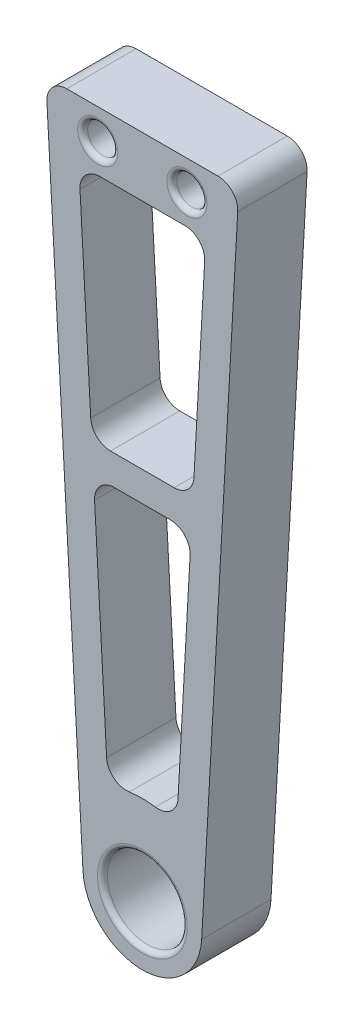
from build123d import *

# Parameters (mm, degrees)
SKETCH_1_R          = 11
SKETCH_1_R_2        = 3.5
SKETCH_1_R_3        = 1.01
SKETCH_1_R_4        = 6
SKETCH_1_R_5        = 4.025
EXTRUDE_1_DEPTH     = 7
SKETCH_2_R          = 1.525
EXTRUDE_2_DEPTH     = 7
SKETCH_3_W          = 24.553172336
SKETCH_3_H          = 36.576889883
CUT_EXTRUDE_1_DEPTH = 29
EXTRUDE_3_DEPTH     = 7
FILLET_1_R          = 2
FILLET_2_R          = 0.5


with BuildPart() as part:
    # 草图1 → 凸台-拉伸1 (new body)
    # profile 1 of 3: a face of its own
    with BuildSketch(Plane.XY):
        with BuildLine():
            ThreePointArc((10.983011573, -0.611111111), (0, -11), (-10.983011573, -0.611111111))
            Line((-10.983011573, -0.611111111), (-5.990733585, -90.333333333))
            ThreePointArc((-5.990733585, -90.333333333), (-0.166731054, -84.002317051), (6, -90))
            ThreePointArc((6, -90), (5.997682949, -90.166731054), (5.990733585, -90.333333333))
            Line((5.990733585, -90.333333333), (10.983011573, -0.611111111))
        make_face()
        with BuildLine():
            Line((-3.466771313, -81.694489982), (-7.418369738, -10.675569794))
            ThreePointArc((-7.418369738, -10.675569794), (0, -13), (7.418369738, -10.675569794))
            Line((7.418369738, -10.675569794), (3.466771313, -81.694489982))
            ThreePointArc((3.466771313, -81.694489982), (0, -81), (-3.466771313, -81.694489982))
        make_face(mode=Mode.SUBTRACT)
    # profile 2 of 3: a face of its own
    with BuildSketch(Plane.XY):
        Circle(SKETCH_1_R)
        Circle(SKETCH_1_R_2, mode=Mode.SUBTRACT)
        with Locations((-2.75, 4.763139721)):
            Circle(SKETCH_1_R_3, mode=Mode.SUBTRACT)
        with Locations((-2.75, -4.763139721)):
            Circle(SKETCH_1_R_3, mode=Mode.SUBTRACT)
        with Locations((5.5, 0)):
            Circle(SKETCH_1_R_3, mode=Mode.SUBTRACT)
    # profile 3 of 3: a face of its own
    with BuildSketch(Plane.XY):
        with Locations((0, -90)):
            Circle(SKETCH_1_R_4)
        with Locations((0, -90)):
            Circle(SKETCH_1_R_5, mode=Mode.SUBTRACT)
    extrude(amount=EXTRUDE_1_DEPTH)

    # 草图2 → 凸台-拉伸2 (add)
    with BuildSketch(Plane.XY.offset(7)):
        Polygon((-6.745155967, -22.774702841), (6.745155967, -22.774702841), (6.411307036, -28.774702841), (-6.411307036, -28.774702841), align=None)
        with Locations((-4.5, -25.774702841)):
            Circle(SKETCH_2_R, mode=Mode.SUBTRACT)
        with Locations((4.5, -25.774702841)):
            Circle(SKETCH_2_R, mode=Mode.SUBTRACT)
    extrude(amount=-EXTRUDE_2_DEPTH)

    # 草图3 → 切除-拉伸1 (cut)
    with BuildSketch(Plane.XY.offset(7)):
        with Locations((0.16395552, -4.486257899)):
            Rectangle(SKETCH_3_W, SKETCH_3_H)
    extrude(amount=-CUT_EXTRUDE_1_DEPTH, mode=Mode.SUBTRACT)

    # 草图4 → 凸台-拉伸3 (add)
    with BuildSketch(Plane.XY.offset(7)):
        Polygon((-5.10596364, -52.234596412), (5.10596364, -52.234596412), (4.939039175, -55.234596412), (-4.939039175, -55.234596412), align=None)
    extrude(amount=-EXTRUDE_3_DEPTH)

    # 圆角1
    fillet_1_edges = [part.edges().sort_by_distance(p)[0] for p in [
        (-4.939039175, -55.234596412, 3.5),
        (-5.10596364, -52.234596412, 3.5),
        (5.10596364, -52.234596412, 3.5),
        (4.939039175, -55.234596412, 3.5),
        (-3.466771313, -81.694489982, 3.5),
        (3.466771313, -81.694489982, 3.5),
        (6.411307036, -28.774702841, 3.5),
        (-6.411307036, -28.774702841, 3.5),
        (-9.749796341, -22.774702841, 3.5),
        (9.749796341, -22.774702841, 3.5),
    ]]
    fillet(fillet_1_edges, radius=FILLET_1_R)

    # 圆角2
    fillet_2_edges = [part.edges().sort_by_distance(p)[0] for p in [
        (-4.025, -90, 0),
        (-6.025, -25.774702841, 0),
        (-6.025, -25.774702841, 7),
        (2.975, -25.774702841, 0),
        (2.975, -25.774702841, 7),
        (-4.025, -90, 7),
    ]]
    fillet(fillet_2_edges, radius=FILLET_2_R)


solid = part.part
